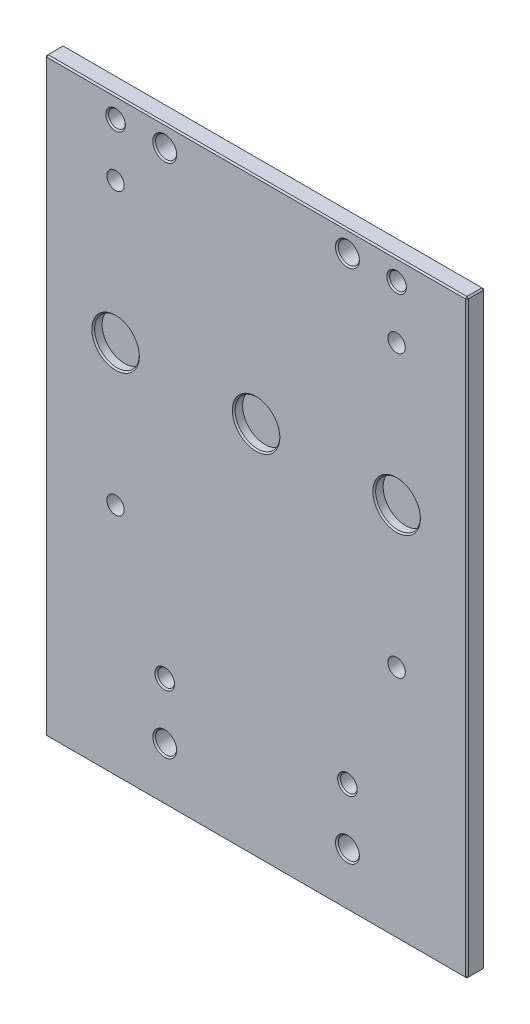
from build123d import *

# Parameters (mm, degrees)
SKETCH1_W                            = 150
SKETCH1_H                            = 210
SKETCH1_R                            = 2.98
SKETCH1_R_2                          = 3.75
BOSS_EXTRUDE1_DEPTH                  = 6.35
SKETCH2_R                            = 7.9577
CUT_EXTRUDE1_DEPTH                   = 3.175
F_15_64_0_23438_DIAMETER_HOLE1_D     = 6.1849
F_15_64_0_23438_DIAMETER_HOLE1_DEPTH = 7.35
F_15_64_0_23438_DIAMETER_HOLE1_TIP   = 1.858131421
CHAMFER1_SIZE                        = 0.5
SKETCH6_R                            = 7.9577
CUT_EXTRUDE2_DEPTH                   = 3.175
CHAMFER2_SIZE                        = 0.5


with BuildPart() as part:
    # Sketch1 → Boss-Extrude1 (new body)
    with BuildSketch(Plane.XY):
        with Locations((75, 105)):
            Rectangle(SKETCH1_W, SKETCH1_H)
        with Locations((25, 202.5)):
            Circle(SKETCH1_R, mode=Mode.SUBTRACT)
        with Locations((125, 202.5)):
            Circle(SKETCH1_R, mode=Mode.SUBTRACT)
        with Locations((42.5, 202.5)):
            Circle(SKETCH1_R_2, mode=Mode.SUBTRACT)
        with Locations((107.5, 202.5)):
            Circle(SKETCH1_R_2, mode=Mode.SUBTRACT)
        with Locations((107.5, 39)):
            Circle(SKETCH1_R, mode=Mode.SUBTRACT)
        with Locations((42.5, 39)):
            Circle(SKETCH1_R, mode=Mode.SUBTRACT)
        with Locations((42.5, 19)):
            Circle(SKETCH1_R_2, mode=Mode.SUBTRACT)
        with Locations((107.5, 19)):
            Circle(SKETCH1_R_2, mode=Mode.SUBTRACT)
    extrude(amount=BOSS_EXTRUDE1_DEPTH)

    # Sketch2 → Cut-Extrude1 (cut)
    with BuildSketch(Plane.XY.offset(6.35)):
        with Locations((75, 133.75)):
            Circle(SKETCH2_R)
    extrude(amount=-CUT_EXTRUDE1_DEPTH, mode=Mode.SUBTRACT)

    # 15/64 (0.23438) Diameter Hole1
    with Locations(Plane(origin=(25, 183.75, 6.35), x_dir=(1, 0, 0), z_dir=(0, 0, 1))):
        with Locations((0, 0), (100, 0), (100, -100), (0, -100)):
            Hole(F_15_64_0_23438_DIAMETER_HOLE1_D / 2, depth=F_15_64_0_23438_DIAMETER_HOLE1_DEPTH)
            with Locations((0, 0, -(F_15_64_0_23438_DIAMETER_HOLE1_DEPTH + F_15_64_0_23438_DIAMETER_HOLE1_TIP / 2))):  # 118° drill point
                Cone(0, F_15_64_0_23438_DIAMETER_HOLE1_D / 2, F_15_64_0_23438_DIAMETER_HOLE1_TIP, mode=Mode.SUBTRACT)

    # Chamfer1
    chamfer1_edges = [part.edges().sort_by_distance(p)[0] for p in [
        (0, 105, 6.35),
        (104.52, 39, 0),
        (104.52, 39, 6.35),
        (75, 0, 6.35),
        (22.02, 202.5, 0),
        (22.02, 202.5, 6.35),
        (122.02, 202.5, 0),
        (122.02, 202.5, 6.35),
        (38.75, 202.5, 0),
        (38.75, 202.5, 6.35),
        (103.75, 202.5, 0),
        (103.75, 202.5, 6.35),
        (39.52, 39, 0),
        (39.52, 39, 6.35),
        (38.75, 19, 0),
        (38.75, 19, 6.35),
        (103.75, 19, 0),
        (103.75, 19, 6.35),
        (150, 105, 6.35),
        (75, 0, 0),
        (67.0423, 133.75, 6.35),
        (0, 105, 0),
        (75, 210, 0),
        (150, 105, 0),
        (75, 210, 6.35),
        (150, 0, 3.175),
        (0, 0, 3.175),
        (0, 210, 3.175),
        (150, 210, 3.175),
    ]]
    chamfer(chamfer1_edges, length=CHAMFER1_SIZE)

    # Sketch6 → Cut-Extrude2 (cut)
    with BuildSketch(Plane.XY.offset(6.35)):
        with Locations((125, 133.75)):
            Circle(SKETCH6_R)
        with Locations((25, 133.75)):
            Circle(SKETCH6_R)
    extrude(amount=-CUT_EXTRUDE2_DEPTH, mode=Mode.SUBTRACT)

    # Chamfer2
    chamfer2_edges = [part.edges().sort_by_distance(p)[0] for p in [
        (117.0423, 133.75, 6.35),
        (17.0423, 133.75, 6.35),
    ]]
    chamfer(chamfer2_edges, length=CHAMFER2_SIZE)


solid = part.part
